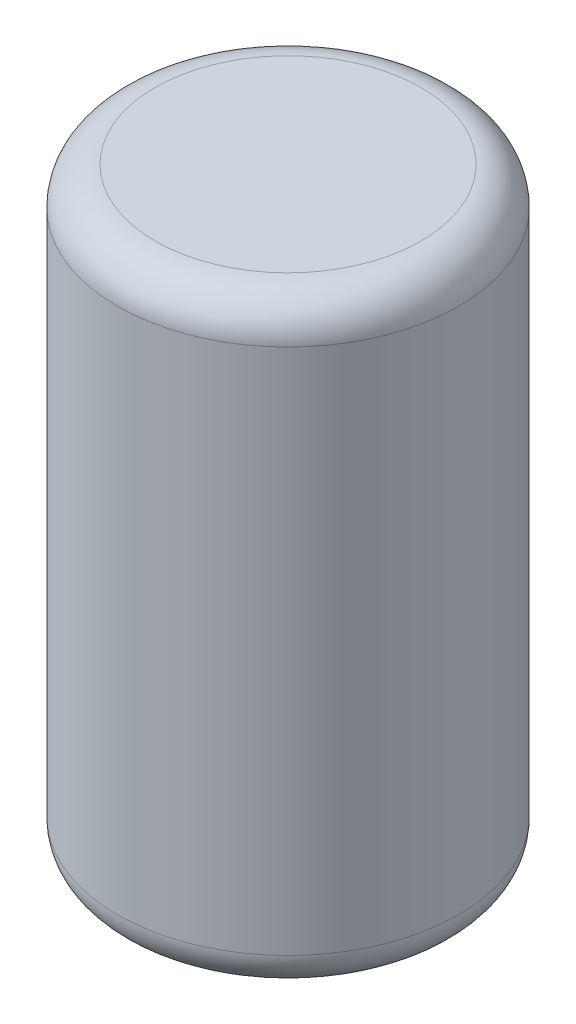
from build123d import *

# Parameters (mm, degrees)
SKETCH1_R           = 3.4
BOSS_EXTRUDE1_DEPTH = 12
FILLET1_R           = 0.75


with BuildPart() as part:
    # Sketch1 → Boss-Extrude1 (new body)
    with BuildSketch(Plane(origin=(0, 0, 0), x_dir=(1, 0, 0), z_dir=(0, 1, 0))):
        with Locations(Location((0, 0, 0), (0, 0, 270))):
            Circle(SKETCH1_R)
    extrude(amount=BOSS_EXTRUDE1_DEPTH)

    # Fillet1
    fillet1_edges = [part.edges().sort_by_distance(p)[0] for p in [
        (0, 0, -3.4),
        (0, 12, -3.4),
    ]]
    fillet(fillet1_edges, radius=FILLET1_R)


solid = part.part
